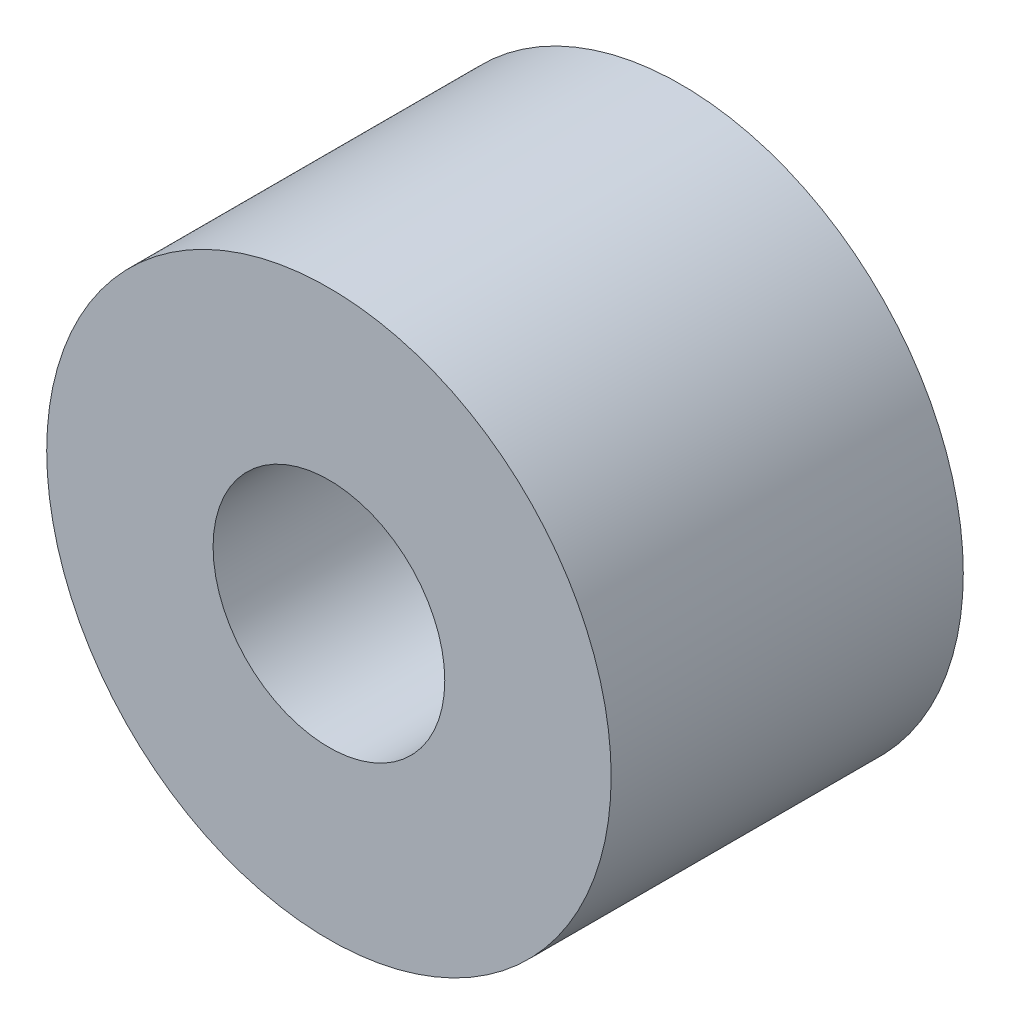
from build123d import *

# Parameters (mm, degrees)
CROQUIS1_R              = 8.575898486
CROQUIS1_R_2            = 3.520233582
SALIENTE_EXTRUIR1_DEPTH = 10.7


with BuildPart() as part:
    # Croquis1 → Saliente-Extruir1 (new body)
    with BuildSketch(Plane.XY):
        with Locations((69.170820019, 22.830838948)):
            Circle(CROQUIS1_R)
        with Locations((69.170820019, 22.830838948)):
            Circle(CROQUIS1_R_2, mode=Mode.SUBTRACT)
    extrude(amount=SALIENTE_EXTRUIR1_DEPTH)


solid = part.part
